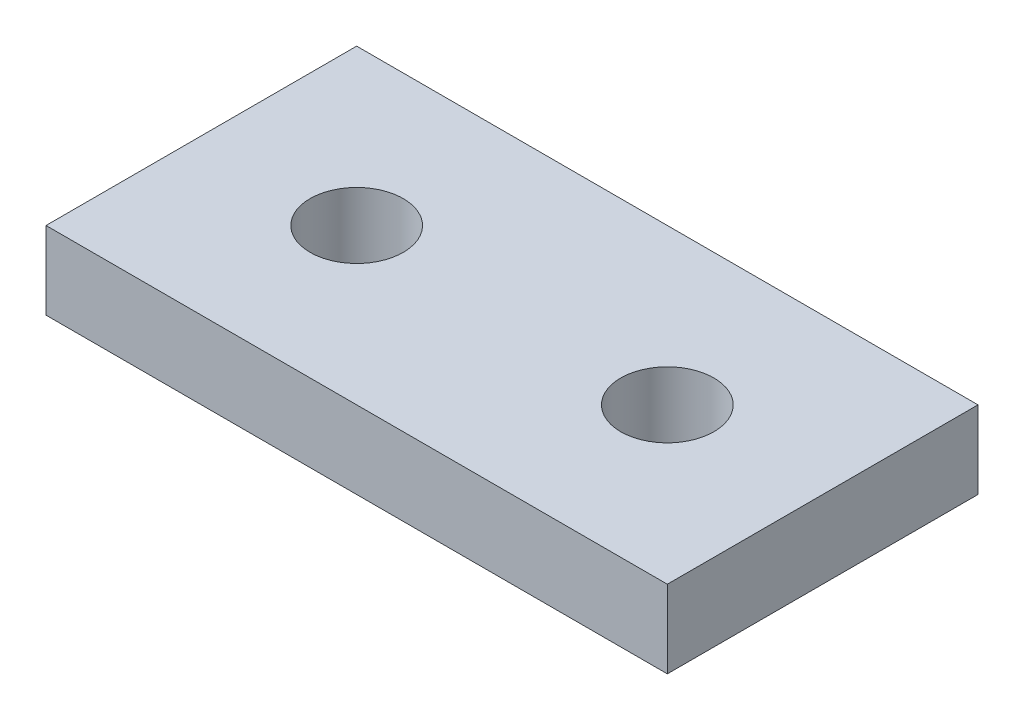
from build123d import *

# Parameters (mm, degrees)
SKETCH1_W           = 40
SKETCH1_H           = 20
SKETCH1_R           = 3
BOSS_EXTRUDE1_DEPTH = 5


with BuildPart() as part:
    # Sketch1 → Boss-Extrude1 (new body)
    with BuildSketch(Plane(origin=(0, 0, 0), x_dir=(1, 0, 0), z_dir=(0, 1, 0))):
        with Locations((-11.25, -2.65625)):
            Rectangle(SKETCH1_W, SKETCH1_H)
        with Locations(Location((-21.25, -2.65625, 0), (0, 0, 270))):
            Circle(SKETCH1_R, mode=Mode.SUBTRACT)
        with Locations(Location((-1.25, -2.65625, 0), (0, 0, 270))):
            Circle(SKETCH1_R, mode=Mode.SUBTRACT)
    extrude(amount=BOSS_EXTRUDE1_DEPTH)


solid = part.part
